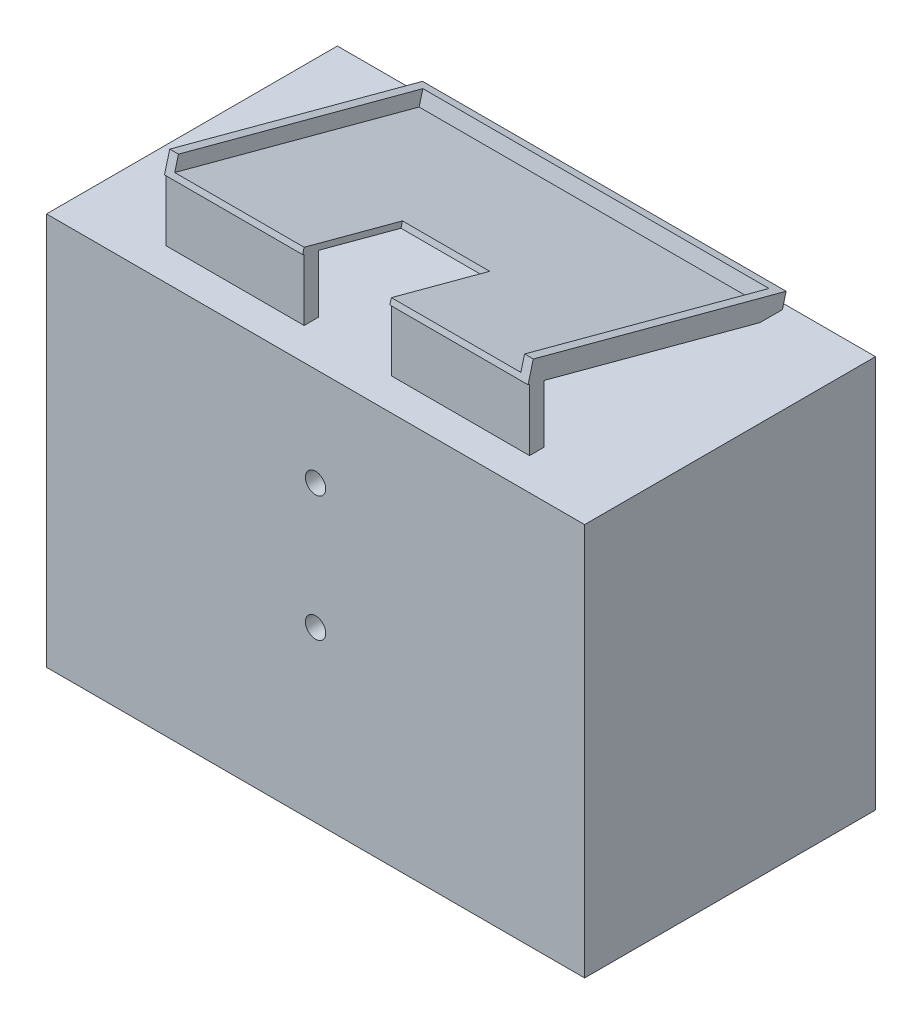
from build123d import *

# Parameters (mm, degrees)
ESBO_O1_W                 = 185
ESBO_O1_H                 = 135
RESSALTO_EXTRUS_O1_DEPTH  = 5
RESSALTO_EXTRUS_O4_START  = 95
ESBO_O1_2_W               = 185
ESBO_O1_2_H               = 135
RESSALTO_EXTRUS_O4_DEPTH  = 5
ESBO_O3_W                 = 185
ESBO_O3_H                 = 100
RESSALTO_EXTRUS_O5_DEPTH  = 5
ESBO_O4_W                 = 100
ESBO_O4_H                 = 135
RESSALTO_EXTRUS_O6_DEPTH  = 5
RESSALTO_EXTRUS_O7_START  = -185
ESBO_O4_3_W               = 100
ESBO_O4_3_H               = 135
RESSALTO_EXTRUS_O7_DEPTH  = 5
ESBO_O8_R                 = 3.5
CORTE_EXTRUS_O1_DEPTH     = 10
RESSALTO_EXTRUS_O10_START = -83.2
ESBO_O10_R                = 2.5
RESSALTO_EXTRUS_O10_DEPTH = 7
CORTE_EXTRUS_O2_START     = -2
CORTE_EXTRUS_O2_DEPTH     = 6
ESBO_O12_R                = 3.5
CORTE_EXTRUS_O4_DEPTH     = 6
ESBO_O13_W                = 30
ESBO_O13_H                = 40
CORTE_EXTRUS_O5_DEPTH     = 2
RESSALTO_EXTRUS_O15_START = -30
RESSALTO_EXTRUS_O15_DEPTH = 125
ESBO_O20_W                = 125
ESBO_O20_H                = 91.931851656
RESSALTO_EXTRUS_O20_DEPTH = 2
RESSALTO_EXTRUS_O21_DEPTH = 5
ESBO_O22_W                = 30
ESBO_O22_H                = 35
CORTE_EXTRUS_O6_DEPTH     = 2
ESBO_O23_W                = 30
ESBO_O23_H                = 21.223161699
CORTE_EXTRUS_O7_DEPTH     = 5


with BuildPart() as part:
    # Esboço1 → Ressalto-extrusão1 (new body)
    with BuildSketch(Plane.XY):
        with Locations((13.448247946, -22.785875217)):
            Rectangle(ESBO_O1_W, ESBO_O1_H)
    extrude(amount=RESSALTO_EXTRUS_O1_DEPTH)



with BuildPart() as body_2:
    # Esboço1<2> → Ressalto-extrusão4 (new body)
    with BuildSketch(Plane.XY.offset(RESSALTO_EXTRUS_O4_START)):
        with Locations((13.448247946, -22.785875217)):
            Rectangle(ESBO_O1_2_W, ESBO_O1_2_H)
    extrude(amount=RESSALTO_EXTRUS_O4_DEPTH)


with BuildPart() as part_1:
    add(part.part)

    add(body_2.part)  # Ressalto-extrusão5 merges body 2
    # Esboço3 → Ressalto-extrusão5 (add)
    with BuildSketch(Plane(origin=(0, 44.714124783, 0), x_dir=(1, 0, 0), z_dir=(0, 1, 0))):
        with Locations((13.448247946, -50)):
            Rectangle(ESBO_O3_W, ESBO_O3_H)
    extrude(amount=-RESSALTO_EXTRUS_O5_DEPTH)

    # Esboço4 → Ressalto-extrusão6 (add)
    with BuildSketch(Plane.ZY.offset(79.051752054)):
        with Locations((50, -22.785875217)):
            Rectangle(ESBO_O4_W, ESBO_O4_H)
    extrude(amount=-RESSALTO_EXTRUS_O6_DEPTH)

    # Esboço4<3> → Ressalto-extrusão7 (add)
    with BuildSketch(Plane.ZY.offset(79.051752054).offset(RESSALTO_EXTRUS_O7_START)):
        with Locations((50, -22.785875217)):
            Rectangle(ESBO_O4_3_W, ESBO_O4_3_H)
    extrude(amount=RESSALTO_EXTRUS_O7_DEPTH)

    # Esboço8 → Corte-extrusão1 (cut)
    with BuildSketch(Plane.XY.offset(100)):
        with Locations((13.448247946, 10.836303666)):
            Circle(ESBO_O8_R)
        with Locations((13.448247946, -32.163696334)):
            Circle(ESBO_O8_R)
    extrude(amount=-CORTE_EXTRUS_O1_DEPTH, mode=Mode.SUBTRACT)

    # Esboço10 → Ressalto-extrusão10 (add)
    # profile 1 of 2: a face of its own
    with BuildSketch(Plane(origin=(0, 0, 0), x_dir=(1, 0, 0), z_dir=(0, 1, 0)).offset(RESSALTO_EXTRUS_O10_START)):
        with BuildLine():
            Line((100.948247946, -55), (92.948247946, -55))
            ThreePointArc((92.948247946, -55), (86.948247946, -49), (92.948247946, -43))
            Line((92.948247946, -43), (100.948247946, -43))
            Line((100.948247946, -43), (100.948247946, -55))
        make_face()
        with Locations((92.948247946, -49)):
            Circle(ESBO_O10_R, mode=Mode.SUBTRACT)
    # profile 2 of 2: a face of its own
    with BuildSketch(Plane(origin=(0, 0, 0), x_dir=(1, 0, 0), z_dir=(0, 1, 0)).offset(RESSALTO_EXTRUS_O10_START)):
        with BuildLine():
            Line((-74.051752054, -43), (-74.051752054, -55))
            Line((-74.051752054, -55), (-66.051752054, -55))
            ThreePointArc((-66.051752054, -55), (-60.051752054, -49), (-66.051752054, -43))
            Line((-66.051752054, -43), (-74.051752054, -43))
        make_face()
        with Locations((-66.051752054, -49)):
            Circle(ESBO_O10_R, mode=Mode.SUBTRACT)
    extrude(amount=-RESSALTO_EXTRUS_O10_DEPTH)

    # Esboço11 → Corte-extrusão2 (cut)
    with BuildSketch(Plane.XZ.offset(90.2).offset(CORTE_EXTRUS_O2_START)):
        Polygon((-61.75961018, 51.564667257), (-66.126748114, 53.999437527), (-70.418889987, 51.43477027), (-70.343893927, 46.435332743), (-65.976755993, 44.000562473), (-61.68461412, 46.56522973), align=None)
        Polygon((88.581110013, 46.56522973), (88.656106073, 51.564667257), (93.023244007, 53.999437527), (97.31538588, 51.43477027), (97.24038982, 46.435332743), (92.873251886, 44.000562473), align=None)
    extrude(amount=-CORTE_EXTRUS_O2_DEPTH, mode=Mode.SUBTRACT)

    # Esboço12 → Corte-extrusão4 (cut)
    with BuildSketch(Plane.ZY.offset(79.051752054)):
        with Locations((25, -5.285875217)):
            Circle(ESBO_O12_R)
    extrude(amount=-CORTE_EXTRUS_O4_DEPTH, mode=Mode.SUBTRACT)

    # Esboço13 → Corte-extrusão5 (cut)
    with BuildSketch(Plane(origin=(-74.051752054, 0, 0), x_dir=(0, 0, -1), z_dir=(1, 0, 0))):
        with Locations((-25, -5.285875217)):
            Rectangle(ESBO_O13_W, ESBO_O13_H)
    extrude(amount=-CORTE_EXTRUS_O5_DEPTH, mode=Mode.SUBTRACT)

    # Esboço15 → Ressalto-extrusão15 (add)
    with BuildSketch(Plane(origin=(105.948247946, 0, 0), x_dir=(0, 0, -1), z_dir=(1, 0, 0)).offset(RESSALTO_EXTRUS_O15_START)):
        Polygon((-83.93332437, 66.66809288), (-83.93332437, 44.714124783), (-88.93332437, 44.714124783), (-88.93332437, 68.007838843), align=None)
    extrude(amount=-RESSALTO_EXTRUS_O15_DEPTH)

    # Esboço20 → Ressalto-extrusão20 (add)
    with BuildSketch(Plane(origin=(0, 41.218846376, -11.044556599), x_dir=(1, 0, 0), z_dir=(0, 0.9659258262890665, -0.25881904510252707))):
        with Locations((13.448247946, -57.538792907)):
            Rectangle(ESBO_O20_W, ESBO_O20_H)
    extrude(amount=-RESSALTO_EXTRUS_O20_DEPTH)

    # Esboço21 → Ressalto-extrusão21 (add)
    with BuildSketch(Plane(origin=(0, 41.218846376, -11.044556599), x_dir=(1, 0, 0), z_dir=(0, 0.9659258262890684, -0.2588190451025204))):
        Polygon((75.948247946, -13.504718735), (-49.051752054, -13.504718735), (-49.051752054, -16.504718735), (-49.051752054, -103.504718735), (-46.051752054, -103.504718735), (-46.051752054, -16.504718735), (72.948247946, -16.504718735), (72.948247946, -103.504718735), (75.948247946, -103.504718735), (75.948247946, -16.504718735), align=None)
    extrude(amount=RESSALTO_EXTRUS_O21_DEPTH)

    # Esboço22 → Corte-extrusão6 (cut)
    with BuildSketch(Plane(origin=(0, 41.218846376, -11.044556599), x_dir=(1, 0, 0), z_dir=(0, 0.9659258262890684, -0.2588190451025204))):
        with Locations((13.448247946, -86.004718735)):
            Rectangle(ESBO_O22_W, ESBO_O22_H)
    extrude(amount=-CORTE_EXTRUS_O6_DEPTH, mode=Mode.SUBTRACT)

    # Esboço23 → Corte-extrusão7 (cut)
    with BuildSketch(Plane.XY.offset(88.93332437)):
        with Locations((13.448247946, 55.325705633)):
            Rectangle(ESBO_O23_W, ESBO_O23_H)
    extrude(amount=-CORTE_EXTRUS_O7_DEPTH, mode=Mode.SUBTRACT)


solid = part_1.part
